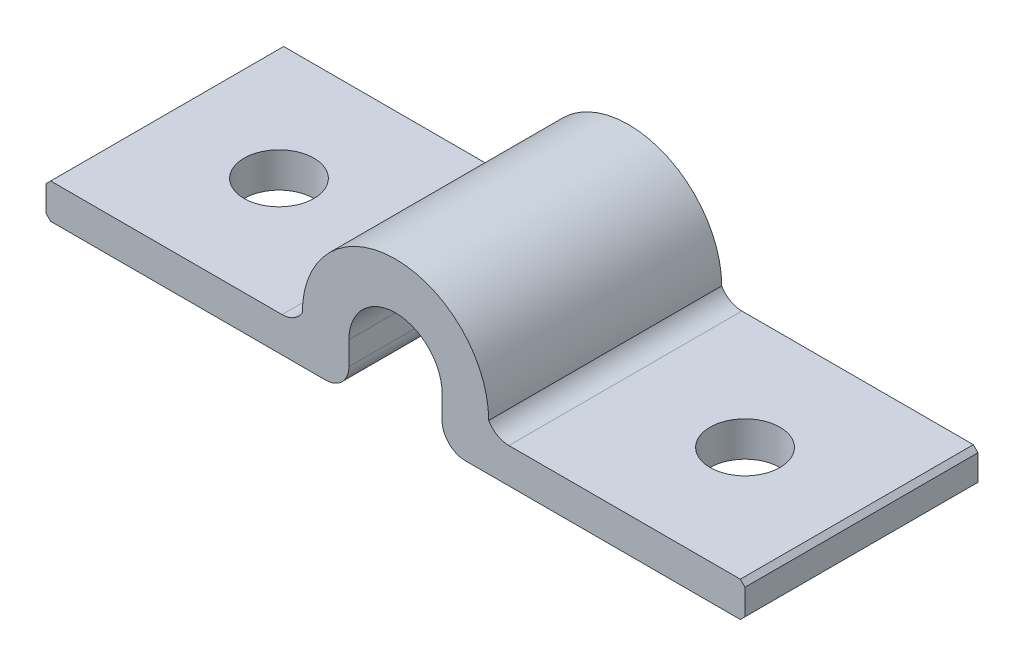
from build123d import *

# Parameters (mm, degrees)
BOSS_EXTRUDE1_DEPTH = 10
SKETCH2_R           = 1.5
CUT_EXTRUDE1_DEPTH  = 30


with BuildPart() as part:
    # Sketch1 → Boss-Extrude1 (new body)
    with BuildSketch(Plane.XY):
        with BuildLine():
            Line((-3, -2), (-14.8, -2))
            Line((-14.8, -2), (-15, -1.8))
            Line((-15, -1.8), (-15, -0.7))
            Line((-15, -0.7), (-14.8, -0.5))
            Line((-14.8, -0.5), (-4.866025404, -0.5))
            ThreePointArc((-4.866025404, -0.5), (-4.366025404, -0.366025404), (-4, 0))
            ThreePointArc((-4, 0), (-2.828427125, 2.828427125), (0, 4))
            Line((0, 4), (0, 2))
            ThreePointArc((0, 2), (-1.414213562, 1.414213562), (-2, 0))
            Line((-2, 0), (-2, -1))
            ThreePointArc((-2, -1), (-2.292893219, -1.707106781), (-3, -2))
        make_face()
    boss_extrude1 = extrude(amount=BOSS_EXTRUDE1_DEPTH)

    # Sketch2 → Cut-Extrude1 (cut)
    with BuildSketch(Plane(origin=(0, -0.5, 0), x_dir=(1, 0, 0), z_dir=(0, 1, 0))):
        with Locations(Location((-10, -5, 0), (0, 0, 180))):
            Circle(SKETCH2_R)
    cut_extrude1 = extrude(amount=-CUT_EXTRUDE1_DEPTH, mode=Mode.SUBTRACT)

    # Mirror1: Boss-Extrude1, Cut-Extrude1 across plane
    add(boss_extrude1.mirror(Plane(origin=(0, 2, 10), x_dir=(0, 0, 1), z_dir=(-1, 0, 0))))
    add(cut_extrude1.mirror(Plane(origin=(0, 2, 10), x_dir=(0, 0, 1), z_dir=(-1, 0, 0))), mode=Mode.SUBTRACT)


solid = part.part
